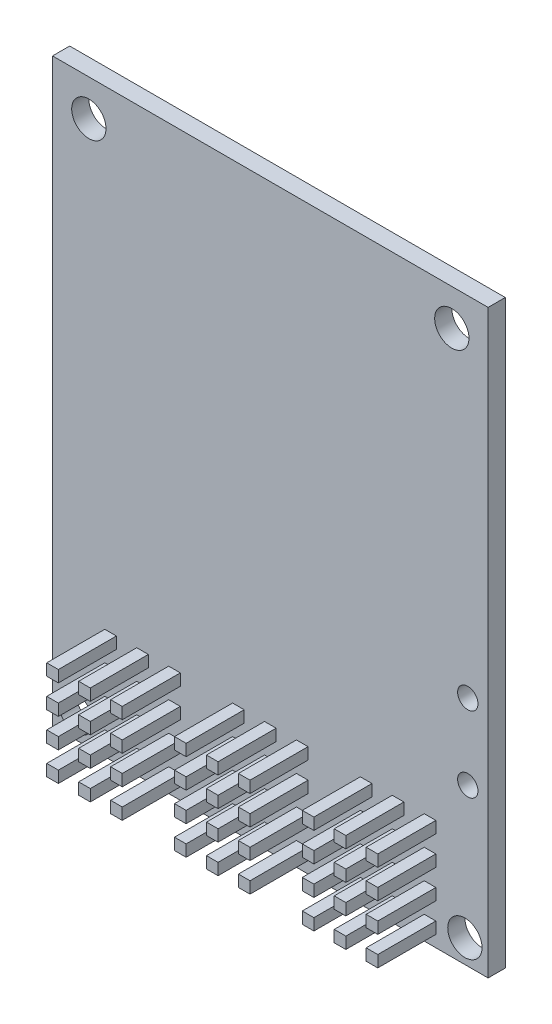
from build123d import *

# Parameters (mm, degrees)
SKETCH1_W           = 38.1
SKETCH1_H           = 50.8
SKETCH1_R           = 1.5
BOSS_EXTRUDE1_DEPTH = 1.5
SKETCH2_R           = 0.889
CUT_EXTRUDE1_DEPTH  = 32.785413321
SKETCH3_W           = 1.016
SKETCH3_H           = 1.016
BOSS_EXTRUDE2_DEPTH = 5.08


with BuildPart() as part:
    # Sketch1 → Boss-Extrude1 (new body)
    with BuildSketch(Plane.XY):
        Rectangle(SKETCH1_W, SKETCH1_H)
        with Locations((-17.018, -23.368)):
            Circle(SKETCH1_R, mode=Mode.SUBTRACT)
        with Locations((-15.875, 22.225)):
            Circle(SKETCH1_R, mode=Mode.SUBTRACT)
        with Locations(Location((17.018, -23.368, 0), (0, 0, 180))):
            Circle(SKETCH1_R, mode=Mode.SUBTRACT)
        with Locations(Location((15.875, 22.225, 0), (0, 0, 180))):
            Circle(SKETCH1_R, mode=Mode.SUBTRACT)
    extrude(amount=BOSS_EXTRUDE1_DEPTH)

    # Sketch2 → Cut-Extrude1 (cut, through all)
    with BuildSketch(Plane.XY.offset(1.5)):
        with Locations((17.272, -11.684)):
            Circle(SKETCH2_R)
        with Locations((17.272, -5.08)):
            Circle(SKETCH2_R)
    extrude(amount=-CUT_EXTRUDE1_DEPTH, mode=Mode.SUBTRACT)

    # Sketch3 → Boss-Extrude2 (add)
    with BuildSketch(Plane.XY.offset(1.5)):
        with Locations((-13.97, -23.876)):
            Rectangle(SKETCH3_W, SKETCH3_H)
        with Locations((-13.97, -21.336)):
            Rectangle(SKETCH3_W, SKETCH3_H)
        with Locations((-13.97, -18.796)):
            Rectangle(SKETCH3_W, SKETCH3_H)
        with Locations((-13.97, -16.256)):
            Rectangle(SKETCH3_W, SKETCH3_H)
        with Locations((-11.176, -23.876)):
            Rectangle(SKETCH3_W, SKETCH3_H)
        with Locations((-11.176, -21.336)):
            Rectangle(SKETCH3_W, SKETCH3_H)
        with Locations((-11.176, -18.796)):
            Rectangle(SKETCH3_W, SKETCH3_H)
        with Locations((-11.176, -16.256)):
            Rectangle(SKETCH3_W, SKETCH3_H)
        with Locations((-8.382, -23.876)):
            Rectangle(SKETCH3_W, SKETCH3_H)
        with Locations((-8.382, -21.336)):
            Rectangle(SKETCH3_W, SKETCH3_H)
        with Locations((-8.382, -18.796)):
            Rectangle(SKETCH3_W, SKETCH3_H)
        with Locations((-8.382, -16.256)):
            Rectangle(SKETCH3_W, SKETCH3_H)
        with Locations((-2.794, -23.876)):
            Rectangle(SKETCH3_W, SKETCH3_H)
        with Locations((-2.794, -21.336)):
            Rectangle(SKETCH3_W, SKETCH3_H)
        with Locations((-2.794, -18.796)):
            Rectangle(SKETCH3_W, SKETCH3_H)
        with Locations((-2.794, -16.256)):
            Rectangle(SKETCH3_W, SKETCH3_H)
        with Locations((0, -23.876)):
            Rectangle(SKETCH3_W, SKETCH3_H)
        with Locations((0, -21.336)):
            Rectangle(SKETCH3_W, SKETCH3_H)
        with Locations((0, -18.796)):
            Rectangle(SKETCH3_W, SKETCH3_H)
        with Locations((0, -16.256)):
            Rectangle(SKETCH3_W, SKETCH3_H)
        with Locations((2.794, -23.876)):
            Rectangle(SKETCH3_W, SKETCH3_H)
        with Locations((2.794, -21.336)):
            Rectangle(SKETCH3_W, SKETCH3_H)
        with Locations((2.794, -18.796)):
            Rectangle(SKETCH3_W, SKETCH3_H)
        with Locations((2.794, -16.256)):
            Rectangle(SKETCH3_W, SKETCH3_H)
        with Locations((8.382, -23.876)):
            Rectangle(SKETCH3_W, SKETCH3_H)
        with Locations((8.382, -21.336)):
            Rectangle(SKETCH3_W, SKETCH3_H)
        with Locations((8.382, -18.796)):
            Rectangle(SKETCH3_W, SKETCH3_H)
        with Locations((8.382, -16.256)):
            Rectangle(SKETCH3_W, SKETCH3_H)
        with Locations((11.176, -23.876)):
            Rectangle(SKETCH3_W, SKETCH3_H)
        with Locations((11.176, -21.336)):
            Rectangle(SKETCH3_W, SKETCH3_H)
        with Locations((11.176, -18.796)):
            Rectangle(SKETCH3_W, SKETCH3_H)
        with Locations((11.176, -16.256)):
            Rectangle(SKETCH3_W, SKETCH3_H)
        with Locations((13.97, -23.876)):
            Rectangle(SKETCH3_W, SKETCH3_H)
        with Locations((13.97, -21.336)):
            Rectangle(SKETCH3_W, SKETCH3_H)
        with Locations((13.97, -18.796)):
            Rectangle(SKETCH3_W, SKETCH3_H)
        with Locations((13.97, -16.256)):
            Rectangle(SKETCH3_W, SKETCH3_H)
    extrude(amount=BOSS_EXTRUDE2_DEPTH)


solid = part.part
